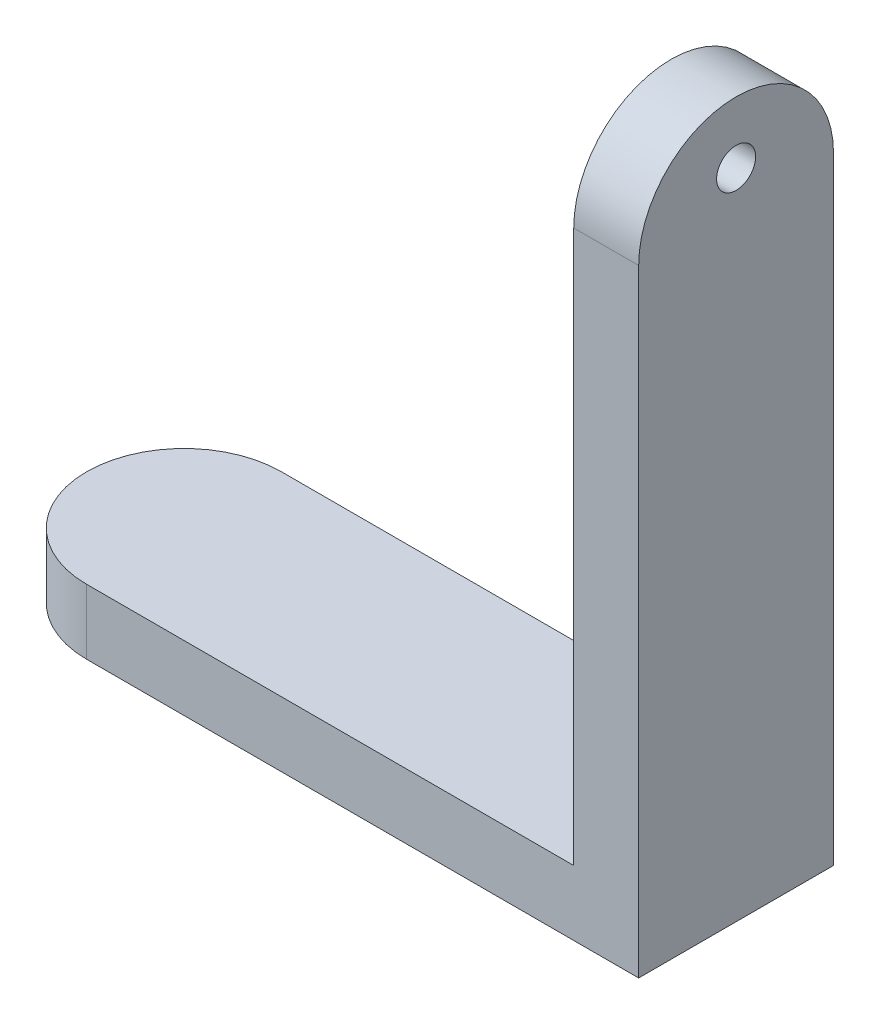
from build123d import *

# Parameters (mm, degrees)
SKETCH1_W           = 25.4
SKETCH1_H           = 7.62
BOSS_EXTRUDE1_DEPTH = 2.54
SKETCH3_W           = 2.54
SKETCH3_H           = 7.62
BOSS_EXTRUDE3_DEPTH = 25.4
FILLET1_RADIUS      = 3.81
FILLET1_LENGTH      = 2.54
SKETCH5_R           = 0.762
CUT_EXTRUDE1_DEPTH  = 25.4
FILLET2_RADIUS      = 3.81
FILLET2_LENGTH      = 2.54


with BuildPart() as part:
    # Sketch1 → Boss-Extrude1 (new body)
    with BuildSketch(Plane(origin=(0, 0, 0), x_dir=(1, 0, 0), z_dir=(0, 1, 0))):
        Rectangle(SKETCH1_W, SKETCH1_H)
    extrude(amount=BOSS_EXTRUDE1_DEPTH)

    # Sketch3 → Boss-Extrude3 (add)
    with BuildSketch(Plane(origin=(0, 2.54, 0), x_dir=(1, 0, 0), z_dir=(0, 1, 0))):
        with Locations((11.43, 0)):
            Rectangle(SKETCH3_W, SKETCH3_H)
    extrude(amount=BOSS_EXTRUDE3_DEPTH)

    # Fillet1: full round fillet: the end face becomes a half cylinder, R = half its width
    fillet1_face = Plane((-12.7, 1.27, 0), x_dir=(0, -1, 0), z_dir=(-1, 0, 0))  # on the end face: x along it, z out of the body
    fillet1_slab = fillet1_face.offset(-FILLET1_RADIUS / 2) * Box(FILLET1_LENGTH, 2 * FILLET1_RADIUS, FILLET1_RADIUS, mode=Mode.PRIVATE)  # the body's end, R deep
    fillet1_round = Plane((-8.89, 1.27, 0), x_dir=(-1, 0, 0), z_dir=(0, -1, 0)) * Cylinder(FILLET1_RADIUS, FILLET1_LENGTH, mode=Mode.PRIVATE)  # its axis R under the face
    add(fillet1_slab - fillet1_round, mode=Mode.SUBTRACT)

    # Sketch5 → Cut-Extrude1 (cut)
    with BuildSketch(Plane.ZY.offset(-10.16)):
        with Locations((0, 25.531689307)):
            Circle(SKETCH5_R)
    extrude(amount=-CUT_EXTRUDE1_DEPTH, mode=Mode.SUBTRACT)

    # Fillet2: full round fillet: the end face becomes a half cylinder, R = half its width
    fillet2_face = Plane((11.43, 27.94, 0), x_dir=(-1, 0, 0), z_dir=(0, 1, 0))  # on the end face: x along it, z out of the body
    fillet2_slab = fillet2_face.offset(-FILLET2_RADIUS / 2) * Box(FILLET2_LENGTH, 2 * FILLET2_RADIUS, FILLET2_RADIUS, mode=Mode.PRIVATE)  # the body's end, R deep
    fillet2_round = Plane((11.43, 24.13, 0), x_dir=(0, 1, 0), z_dir=(-1, 0, 0)) * Cylinder(FILLET2_RADIUS, FILLET2_LENGTH, mode=Mode.PRIVATE)  # its axis R under the face
    add(fillet2_slab - fillet2_round, mode=Mode.SUBTRACT)


solid = part.part
